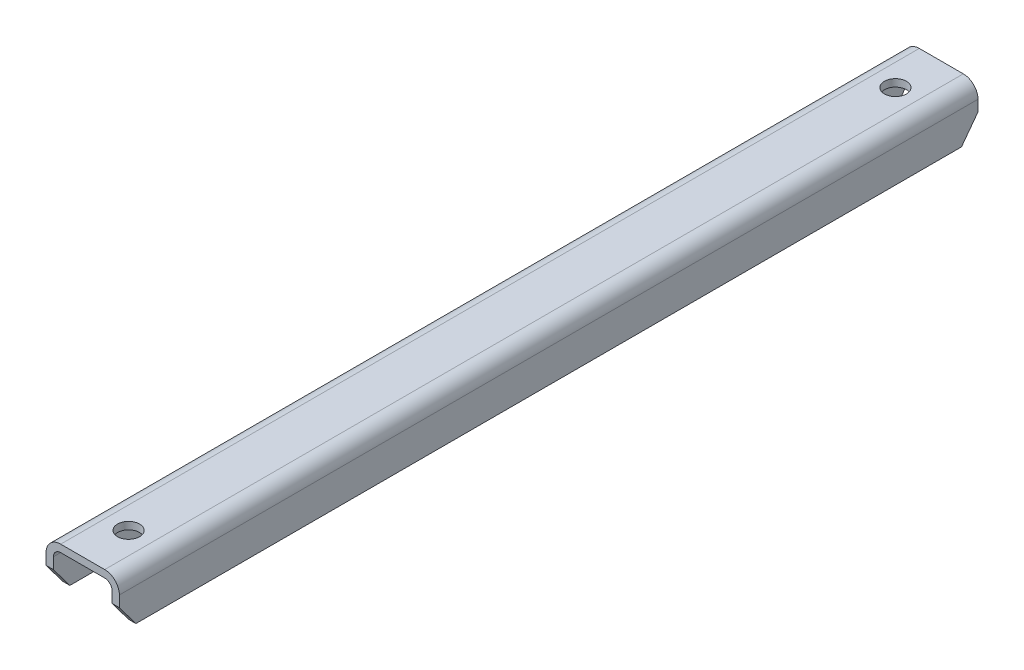
from build123d import *

# Parameters (mm, degrees)
EXTRUDE_1_DEPTH     = 585
CUT_EXTRUDE_1_DEPTH = 350
SKETCH_3_R          = 15
CUT_EXTRUDE_2_DEPTH = 591.719899783


with BuildPart() as part:
    # 草图1 → 凸台-拉伸1 (new, symmetric)
    with BuildSketch(Plane.XY):
        with BuildLine():
            Line((-30, 0), (30, 0))
            ThreePointArc((30, 0), (44.142135624, -5.857864376), (50, -20))
            Line((50, -20), (50, -65))
            Line((50, -65), (40, -65))
            Line((40, -65), (40, -20))
            ThreePointArc((40, -20), (37.071067812, -12.928932188), (30, -10))
            Line((30, -10), (-30, -10))
            ThreePointArc((-30, -10), (-37.071067812, -12.928932188), (-40, -20))
            Line((-40, -20), (-40, -65))
            Line((-40, -65), (-50, -65))
            Line((-50, -65), (-50, -20))
            ThreePointArc((-50, -20), (-44.142135624, -5.857864376), (-30, 0))
        make_face()
    extrude(amount=EXTRUDE_1_DEPTH, both=True)

    # 草图2 → 切除-拉伸1 (cut, symmetric)
    with BuildSketch(Plane(origin=(0, 0, 0), x_dir=(0, 0, -1), z_dir=(1, 0, 0))):
        Polygon((-585, -35), (-585, -65), (-562.5, -65), align=None)
        Polygon((562.5, -65), (585, -35), (585, -65), align=None)
    extrude(amount=CUT_EXTRUDE_1_DEPTH, both=True, mode=Mode.SUBTRACT)

    # 草图3 → 切除-拉伸2 (cut, through all)
    with BuildSketch(Plane(origin=(0, 0, 0), x_dir=(1, 0, 0), z_dir=(0, 1, 0))):
        with Locations(Location((0, 522.5, 0), (0, 0, 270))):
            Circle(SKETCH_3_R)
        with Locations(Location((0, -522.5, 0), (0, 0, 270))):
            Circle(SKETCH_3_R)
    extrude(amount=-CUT_EXTRUDE_2_DEPTH, mode=Mode.SUBTRACT)


solid = part.part
